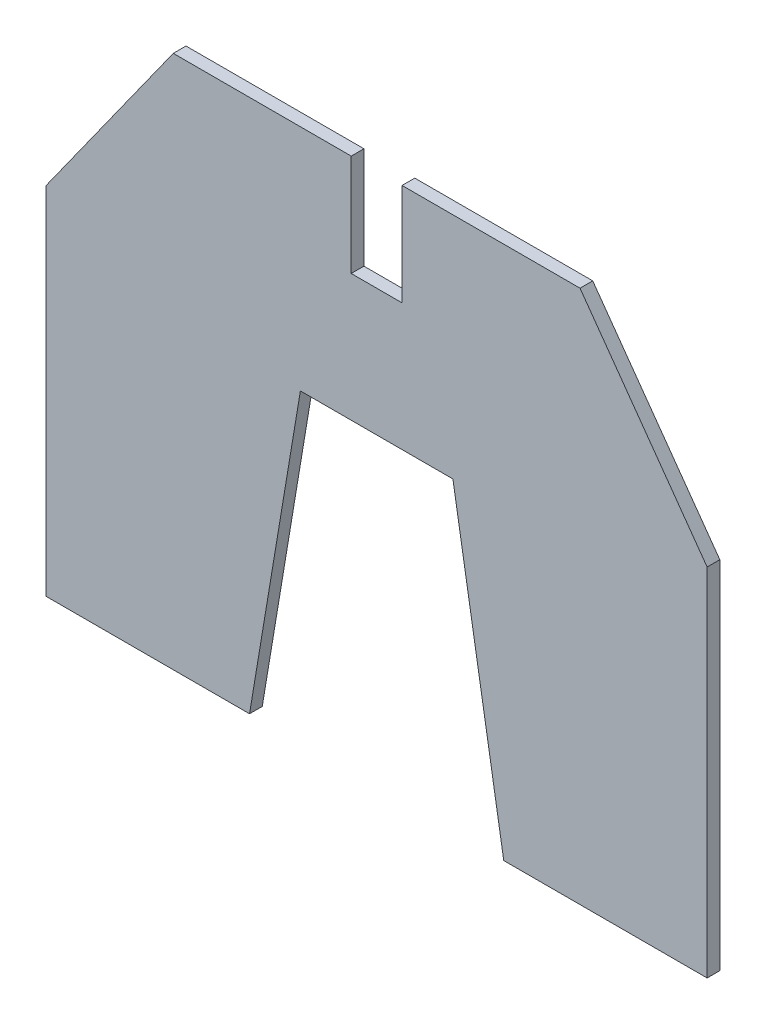
from build123d import *

# Parameters (mm, degrees)
AUFSATZ_LINEAR_AUSTRAGEN1_DEPTH = 2.5


with BuildPart() as part:
    # Skizze1 → Aufsatz-Linear austragen1 (new body)
    with BuildSketch(Plane.XY):
        Polygon((-15, 60), (15, 60), (25, 0), (65, 0), (65, 70), (40, 105), (5, 105), (5, 85), (-5, 85), (-5, 105), (-40, 105), (-65, 70), (-65, 0), (-25, 0), align=None)
    extrude(amount=AUFSATZ_LINEAR_AUSTRAGEN1_DEPTH)


solid = part.part
